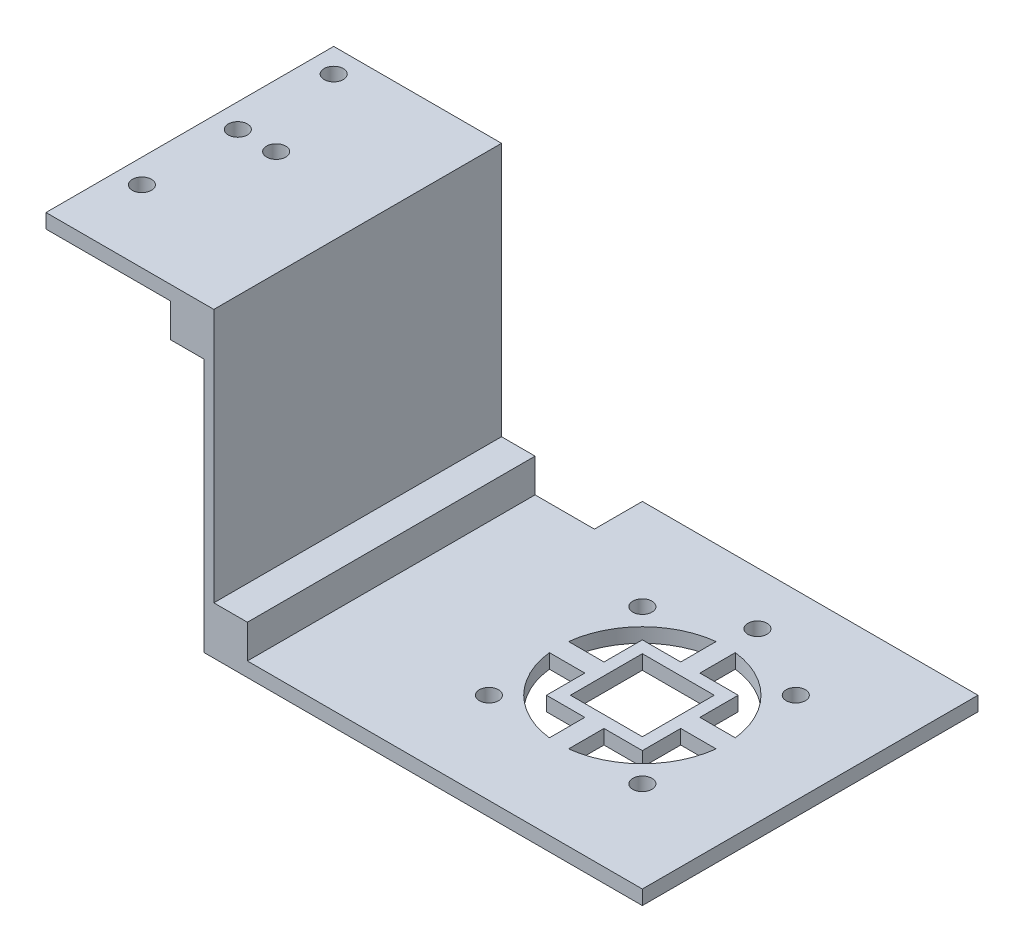
from build123d import *

# Parameters (mm, degrees)
IZIM1_W                     = 75
IZIM1_H                     = 50
Y_KSEKLIK_EKSTR_ZYON1_DEPTH = 3
IZIM8_W                     = 19.632022489
IZIM8_H                     = 50
KES_EKSTR_ZYON4_DEPTH       = 3
IZIM9_W                     = 2
IZIM9_H                     = 50
Y_KSEKLIK_EKSTR_ZYON2_DEPTH = 60
IZIM10_W                    = 35
IZIM10_H                    = 50
Y_KSEKLIK_EKSTR_ZYON3_DEPTH = 3
IZIM12_R                    = 2
KES_EKSTR_ZYON5_DEPTH       = 3
IZIM13_W                    = 20
IZIM13_H                    = 50
Y_KSEKLIK_EKSTR_ZYON4_DEPTH = 3
IZIM14_R                    = 2
KES_EKSTR_ZYON6_DEPTH       = 3
IZIM15_W                    = 15
IZIM15_H                    = 15
KES_EKSTR_ZYON7_DEPTH       = 3
KES_EKSTR_ZYON8_DEPTH       = 3
IZIM17_W                    = 5
IZIM17_H                    = 50
Y_KSEKLIK_EKSTR_ZYON5_DEPTH = 3
Y_KSEKLIK_EKSTR_ZYON6_DEPTH = 3
IZIM19_R                    = 2
KES_EKSTR_ZYON9_DEPTH       = 3
IZIM20_W                    = 7
IZIM20_H                    = 7
Y_KSEKLIK_EKSTR_ZYON7_DEPTH = 50
Y_KSEKLIK_EKSTR_ZYON8_DEPTH = 10


with BuildPart() as part:
    # Çizim1 → Yükseklik-Ekstrüzyon1 (new body)
    with BuildSketch(Plane(origin=(0, 0, 0), x_dir=(1, 0, 0), z_dir=(0, 1, 0))):
        Rectangle(IZIM1_W, IZIM1_H)
    extrude(amount=Y_KSEKLIK_EKSTR_ZYON1_DEPTH)

    # Çizim8 → Kes-Ekstrüzyon4 (cut)
    with BuildSketch(Plane(origin=(0, 3, 0), x_dir=(1, 0, 0), z_dir=(0, 1, 0))):
        with Locations((-27.683988755, 0)):
            Rectangle(IZIM8_W, IZIM8_H)
    extrude(amount=-KES_EKSTR_ZYON4_DEPTH, mode=Mode.SUBTRACT)

    # Çizim9 → Yükseklik-Ekstrüzyon2 (add)
    with BuildSketch(Plane(origin=(0, 0, 0), x_dir=(1, 0, 0), z_dir=(0, 1, 0))):
        with Locations((-18.867977511, 0)):
            Rectangle(IZIM9_W, IZIM9_H)
    extrude(amount=Y_KSEKLIK_EKSTR_ZYON2_DEPTH)

    # Çizim10 → Yükseklik-Ekstrüzyon3 (add)
    with BuildSketch(Plane(origin=(0, 60, 0), x_dir=(1, 0, 0), z_dir=(0, 1, 0))):
        with Locations((-35.367977511, 0)):
            Rectangle(IZIM10_W, IZIM10_H)
    extrude(amount=Y_KSEKLIK_EKSTR_ZYON3_DEPTH)

    # Çizim12 → Kes-Ekstrüzyon5 (cut)
    with BuildSketch(Plane(origin=(0, 63, 0), x_dir=(1, 0, 0), z_dir=(0, 1, 0))):
        with Locations(Location((-39.867977511, 0, 0), (0, 0, 270))):
            Circle(IZIM12_R)
        with Locations(Location((-47.867977511, 0, 0), (0, 0, 270))):
            Circle(IZIM12_R)
        with Locations(Location((-47.867977511, 20, 0), (0, 0, 270))):
            Circle(IZIM12_R)
        with Locations(Location((-47.867977511, -20, 0), (0, 0, 270))):
            Circle(IZIM12_R)
    extrude(amount=-KES_EKSTR_ZYON5_DEPTH, mode=Mode.SUBTRACT)

    # Çizim13 → Yükseklik-Ekstrüzyon4 (add)
    with BuildSketch(Plane(origin=(0, 3, 0), x_dir=(1, 0, 0), z_dir=(0, 1, 0))):
        with Locations((47.5, 0)):
            Rectangle(IZIM13_W, IZIM13_H)
    extrude(amount=-Y_KSEKLIK_EKSTR_ZYON4_DEPTH)

    # Çizim14 → Kes-Ekstrüzyon6 (cut)
    with BuildSketch(Plane(origin=(0, 3, 0), x_dir=(1, 0, 0), z_dir=(0, 1, 0))):
        with Locations(Location((20.5, 16, 0), (0, 0, 270))):
            Circle(IZIM14_R)
        with Locations(Location((52.5, 16, 0), (0, 0, 270))):
            Circle(IZIM14_R)
        with Locations(Location((20.5, -16, 0), (0, 0, 270))):
            Circle(IZIM14_R)
        with Locations(Location((52.5, -16, 0), (0, 0, 270))):
            Circle(IZIM14_R)
    extrude(amount=-KES_EKSTR_ZYON6_DEPTH, mode=Mode.SUBTRACT)

    # Çizim15 → Kes-Ekstrüzyon7 (cut)
    with BuildSketch(Plane(origin=(0, 3, 0), x_dir=(1, 0, 0), z_dir=(0, 1, 0))):
        with Locations((36.5, 0)):
            Rectangle(IZIM15_W, IZIM15_H)
    extrude(amount=-KES_EKSTR_ZYON7_DEPTH, mode=Mode.SUBTRACT)

    # Çizim16 → Kes-Ekstrüzyon8 (cut)
    with BuildSketch(Plane(origin=(0, 3, 0), x_dir=(1, 0, 0), z_dir=(0, 1, 0))):
        with BuildLine():
            Line((46.5, 2), (53.885338651, 2))
            ThreePointArc((53.885338651, 2), (48.874368671, 12.374368671), (38.5, 17.385338651))
            Line((38.5, 17.385338651), (38.5, 10))
            Line((38.5, 10), (46.5, 10))
            Line((46.5, 10), (46.5, 2))
        make_face()
        with BuildLine():
            Line((26.5, 10), (34.5, 10))
            Line((34.5, 10), (34.5, 17.385338651))
            ThreePointArc((34.5, 17.385338651), (24.125631329, 12.374368671), (19.114661349, 2))
            Line((19.114661349, 2), (26.5, 2))
            Line((26.5, 2), (26.5, 10))
        make_face()
        with BuildLine():
            Line((26.5, -10), (34.5, -10))
            Line((34.5, -10), (34.5, -17.385338651))
            ThreePointArc((34.5, -17.385338651), (24.125631329, -12.374368671), (19.114661349, -2))
            Line((19.114661349, -2), (26.5, -2))
            Line((26.5, -2), (26.5, -10))
        make_face()
        with BuildLine():
            Line((46.5, -2), (53.885338651, -2))
            ThreePointArc((53.885338651, -2), (48.874368671, -12.374368671), (38.5, -17.385338651))
            Line((38.5, -17.385338651), (38.5, -10))
            Line((38.5, -10), (46.5, -10))
            Line((46.5, -10), (46.5, -2))
        make_face()
    extrude(amount=-KES_EKSTR_ZYON8_DEPTH, mode=Mode.SUBTRACT)

    # Çizim17 → Yükseklik-Ekstrüzyon5 (add)
    with BuildSketch(Plane(origin=(0, 3, 0), x_dir=(1, 0, 0), z_dir=(0, 1, 0))):
        with Locations((60, 0)):
            Rectangle(IZIM17_W, IZIM17_H)
    extrude(amount=-Y_KSEKLIK_EKSTR_ZYON5_DEPTH)

    # Çizim18 → Yükseklik-Ekstrüzyon6 (add)
    with BuildSketch(Plane(origin=(0, 3, 0), x_dir=(1, 0, 0), z_dir=(0, 1, 0))):
        Polygon((1.5, 25), (62.5, 25), (62.5, -25), (1.5, -25), (1.5, -35), (71.5, -35), (71.5, 35), (1.5, 35), align=None)
    extrude(amount=-Y_KSEKLIK_EKSTR_ZYON6_DEPTH)

    # Çizim19 → Kes-Ekstrüzyon9 (cut)
    with BuildSketch(Plane(origin=(0, 3, 0), x_dir=(1, 0, 0), z_dir=(0, 1, 0))):
        with Locations(Location((36.5, 24, 0), (0, 0, 270))):
            Circle(IZIM19_R)
    extrude(amount=-KES_EKSTR_ZYON9_DEPTH, mode=Mode.SUBTRACT)

    # Çizim20 → Yükseklik-Ekstrüzyon7 (add)
    with BuildSketch(Plane.XY.offset(25)):
        with Locations((-23.367977511, 56.5)):
            Rectangle(IZIM20_W, IZIM20_H)
        with Locations((-14.367977511, 6.5)):
            Rectangle(IZIM20_W, IZIM20_H)
    extrude(amount=-Y_KSEKLIK_EKSTR_ZYON7_DEPTH)

    # Çizim21 → Yükseklik-Ekstrüzyon8 (add)
    with BuildSketch(Plane.XY.offset(25)):
        Polygon((-52.867977511, 60), (-52.867977511, 63), (-17.867977511, 63), (-17.867977511, 10), (-10.867977511, 10), (-10.867977511, 3), (1.5, 3), (1.5, 0), (-19.867977511, 0), (-19.867977511, 53), (-26.867977511, 53), (-26.867977511, 60), align=None)
    extrude(amount=Y_KSEKLIK_EKSTR_ZYON8_DEPTH)


solid = part.part
